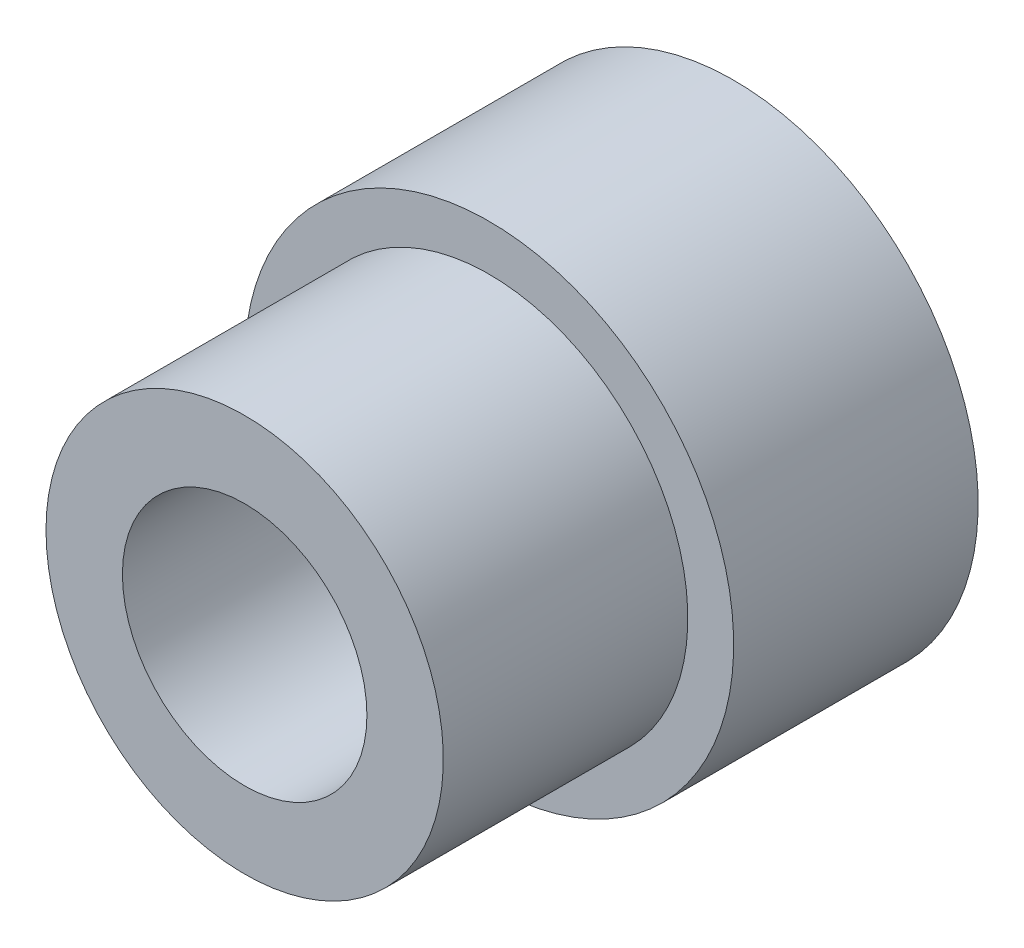
from build123d import *

# Parameters (mm, degrees)
SKETCH1_R           = 9.525
BOSS_EXTRUDE1_DEPTH = 9.525
SKETCH2_R           = 7.7390625
BOSS_EXTRUDE2_DEPTH = 9.525
SKETCH3_R           = 4.7625
CUT_EXTRUDE1_DEPTH  = 24.3313898


with BuildPart() as part:
    # Sketch1 → Boss-Extrude1 (new body)
    with BuildSketch(Plane.XY):
        with Locations(Location((0, 0, 0), (0, 0, 180))):
            Circle(SKETCH1_R)
    extrude(amount=BOSS_EXTRUDE1_DEPTH)

    # Sketch2 → Boss-Extrude2 (add)
    with BuildSketch(Plane.XY.offset(9.525)):
        with Locations(Location((0, 0, 0), (0, 0, 180))):
            Circle(SKETCH2_R)
    extrude(amount=BOSS_EXTRUDE2_DEPTH)

    # Sketch3 → Cut-Extrude1 (cut, through all)
    with BuildSketch(Plane.XY.offset(19.05)):
        Circle(SKETCH3_R)
    extrude(amount=-CUT_EXTRUDE1_DEPTH, mode=Mode.SUBTRACT)


solid = part.part
